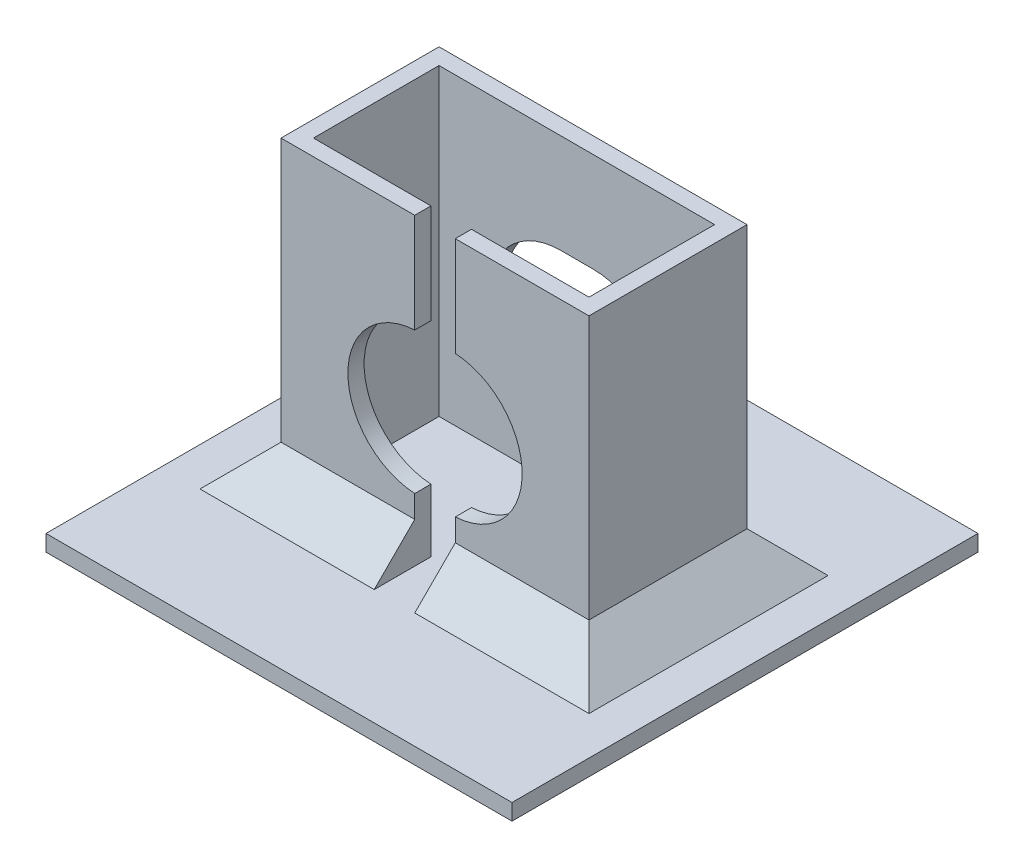
from build123d import *

# Parameters (mm, degrees)
SKETCH1_W           = 76
SKETCH1_H           = 39
SKETCH1_W_2         = 68
SKETCH1_H_2         = 31
BOSS_EXTRUDE2_DEPTH = 75
SKETCH1_9_W         = 115
SKETCH1_9_H         = 115
BOSS_EXTRUDE6_DEPTH = 4
SKETCH9_W           = 10
SKETCH9_H           = 75
CUT_EXTRUDE2_DEPTH  = 6
CUT_EXTRUDE3_DEPTH  = 52
CHAMFER1_SIZE       = 10


with BuildPart() as part:
    # Sketch1 → Boss-Extrude2 (new body)
    with BuildSketch(Plane(origin=(0, 0, 0), x_dir=(1, 0, 0), z_dir=(0, 1, 0))):
        with Locations((34, 15.5)):
            Rectangle(SKETCH1_W, SKETCH1_H)
        with Locations((34, 15.5)):
            Rectangle(SKETCH1_W_2, SKETCH1_H_2, mode=Mode.SUBTRACT)
    extrude(amount=BOSS_EXTRUDE2_DEPTH)

    # Sketch1<9> → Boss-Extrude6 (add)
    with BuildSketch(Plane(origin=(0, 0, 0), x_dir=(1, 0, 0), z_dir=(0, 1, 0))):
        with Locations((34, 15)):
            Rectangle(SKETCH1_9_W, SKETCH1_9_H)
    extrude(amount=-BOSS_EXTRUDE6_DEPTH)

    # Sketch9 → Cut-Extrude2 (cut)
    with BuildSketch(Plane.XY.offset(4)):
        with Locations((34, 37.5)):
            Rectangle(SKETCH9_W, SKETCH9_H)
    extrude(amount=-CUT_EXTRUDE2_DEPTH, mode=Mode.SUBTRACT)

    # Sketch7 → Cut-Extrude3 (cut)
    with BuildSketch(Plane.XY.offset(4)):
        with BuildLine():
            Line((30, 50.5), (38, 50.5))
            ThreePointArc((38, 50.5), (55.5, 33), (38, 15.5))
            Line((38, 15.5), (30, 15.5))
            ThreePointArc((30, 15.5), (12.5, 33), (30, 50.5))
        make_face()
    extrude(amount=-CUT_EXTRUDE3_DEPTH, mode=Mode.SUBTRACT)

    # Chamfer1
    chamfer1_edges = [part.edges().sort_by_distance(p)[0] for p in [
        (12.5, 0, 4),
        (-4, 0, -15.5),
        (55.5, 0, 4),
        (72, 0, -15.5),
        (34, 0, -35),
    ]]
    chamfer(chamfer1_edges, length=CHAMFER1_SIZE)


solid = part.part
